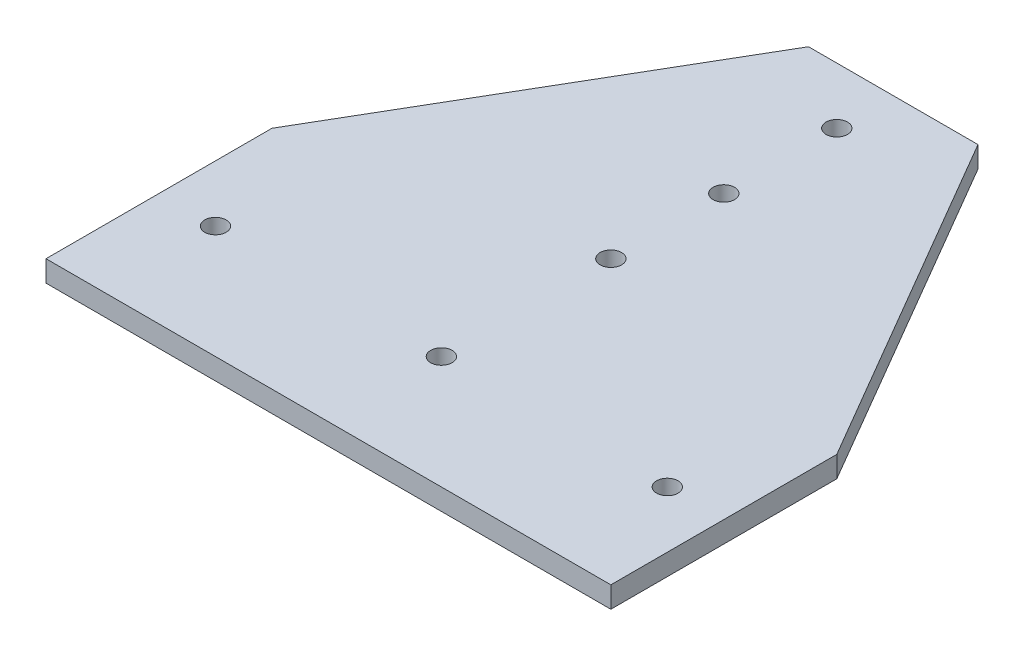
from build123d import *

# Parameters (mm, degrees)
SKETCH1_R           = 2.413
BOSS_EXTRUDE1_DEPTH = 4.7625


with BuildPart() as part:
    # Sketch1 → Boss-Extrude1 (new body)
    with BuildSketch(Plane(origin=(0, 0, 0), x_dir=(1, 0, 0), z_dir=(0, 1, 0))):
        Polygon((-19.05, 63.5), (-63.5, -12.7), (-63.5, -63.5), (63.5, -63.5), (63.5, -12.7), (19.05, 63.5), align=None)
        with Locations(Location((-50.8, -38.1, 0), (0, 0, 90))):
            Circle(SKETCH1_R, mode=Mode.SUBTRACT)
        with Locations(Location((0, -38.1, 0), (0, 0, 90))):
            Circle(SKETCH1_R, mode=Mode.SUBTRACT)
        with Locations(Location((50.8, -38.1, 0), (0, 0, 90))):
            Circle(SKETCH1_R, mode=Mode.SUBTRACT)
        with Locations(Location((0, 25.4, 0), (0, 0, 90))):
            Circle(SKETCH1_R, mode=Mode.SUBTRACT)
        with Locations(Location((0, 50.8, 0), (0, 0, 90))):
            Circle(SKETCH1_R, mode=Mode.SUBTRACT)
        with Locations(Location((0, 0, 0), (0, 0, 90))):
            Circle(SKETCH1_R, mode=Mode.SUBTRACT)
    extrude(amount=BOSS_EXTRUDE1_DEPTH)


solid = part.part
